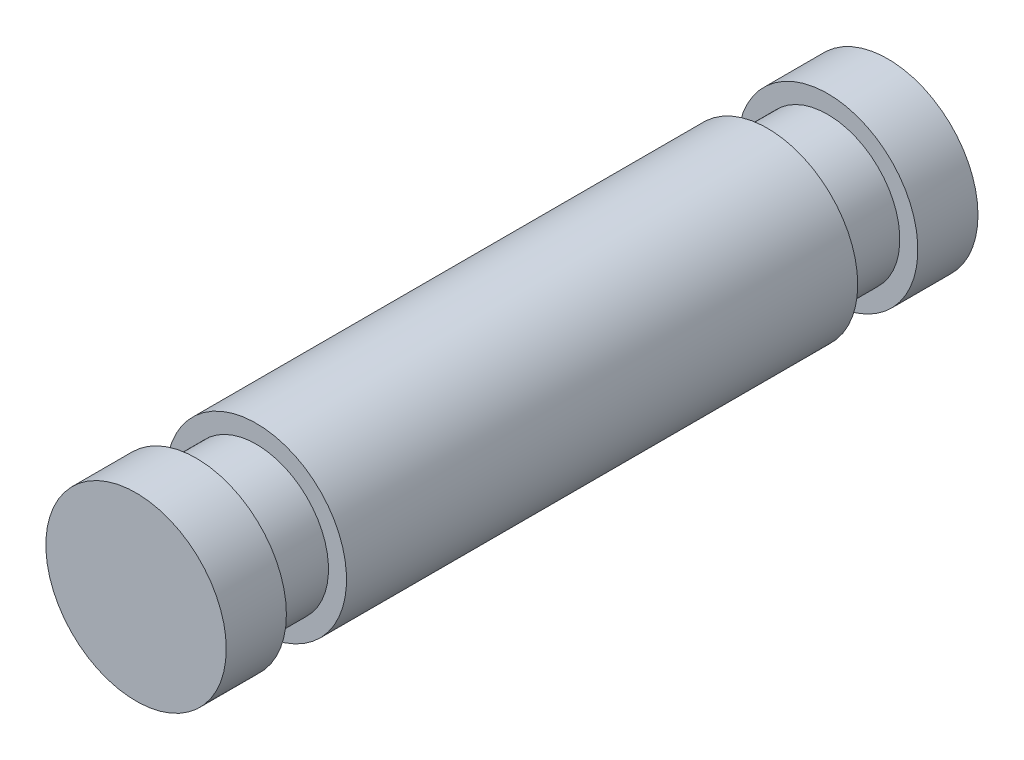
from build123d import *

# Parameters (mm, degrees)
SKETCH1_R           = 1.5
BOSS_EXTRUDE1_DEPTH = 12.5
SKETCH2_W           = 1
SKETCH2_H           = 1.937236023


with BuildPart() as part:
    # Sketch1 → Boss-Extrude1 (new body)
    with BuildSketch(Plane.XY):
        Circle(SKETCH1_R)
    extrude(amount=BOSS_EXTRUDE1_DEPTH)

    # Sketch2 → Cut-Revolve1 (revolve, cut)
    with BuildSketch(Plane(origin=(0, 0, 0), x_dir=(0, 0, -1), z_dir=(1, 0, 0)), mode=Mode.PRIVATE) as cut_revolve1_sk:
        with Locations((-1.5, 2.168618012)):
            Rectangle(SKETCH2_W, SKETCH2_H)
    cut_revolve1 = revolve(cut_revolve1_sk.sketch.rotate(Axis((0, 0, 0), (0, 0, 1)), 90), axis=Axis((0, 0, 0), (0, 0, 1)), mode=Mode.SUBTRACT)

    # Mirror1: Cut-Revolve1 across plane
    add(cut_revolve1.mirror(Plane.XY.offset(6.25)), mode=Mode.SUBTRACT)


solid = part.part
